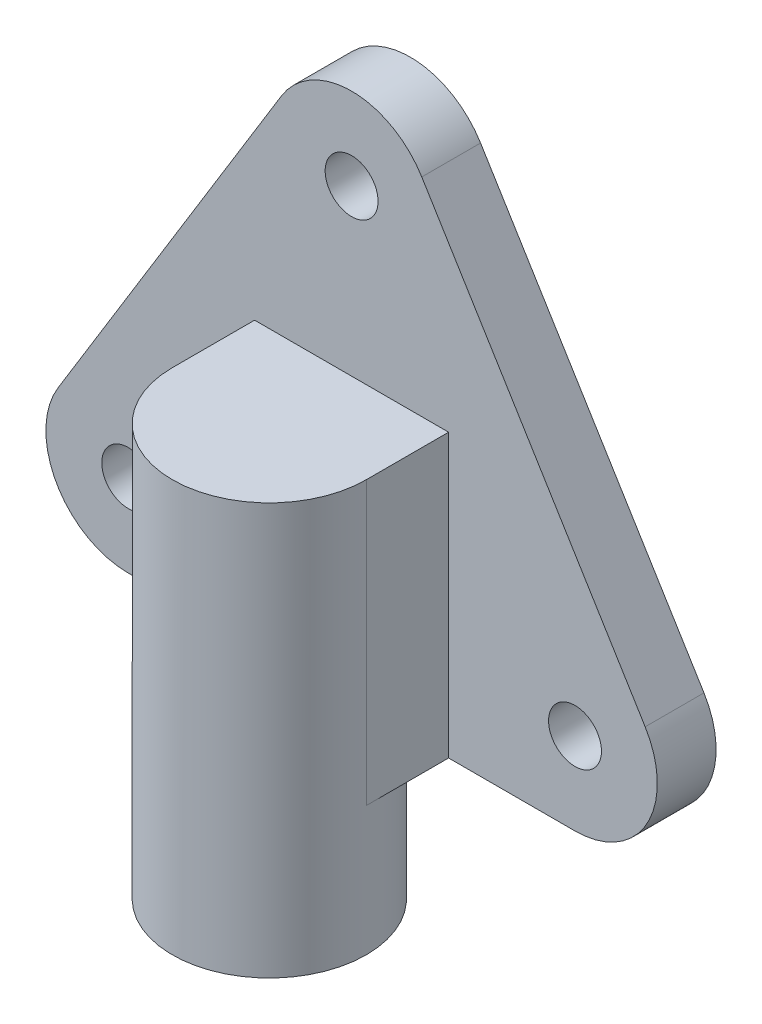
from build123d import *

# Parameters (mm, degrees)
SKETCH1_R                = 4.5
BOSS_EXTRUDE1_DEPTH      = 10
BOSS_EXTRUDE2_DEPTH      = 22
BOSS_EXTRUDE2_DEPTH_BACK = 48
SKETCH2_R                = 16.5
BOSS_EXTRUDE3_DEPTH      = 48
SKETCH5_R                = 8
CUT_EXTRUDE1_DEPTH       = 54


with BuildPart() as part:
    # Sketch1 → Boss-Extrude1 (new body)
    with BuildSketch(Plane.XY):
        with BuildLine():
            Line((-38, -14), (38, -14))
            ThreePointArc((38, -14), (50.215198798, -6.840242563), (49.936417534, 7.315868811))
            Line((49.936417534, 7.315868811), (11.936417534, 69.315868811))
            ThreePointArc((11.936417534, 69.315868811), (0, 76), (-11.936417534, 69.315868811))
            Line((-11.936417534, 69.315868811), (-49.936417534, 7.315868811))
            ThreePointArc((-49.936417534, 7.315868811), (-50.215198798, -6.840242563), (-38, -14))
        make_face()
        with Locations((0, 62)):
            Circle(SKETCH1_R, mode=Mode.SUBTRACT)
        with Locations((38, 0)):
            Circle(SKETCH1_R, mode=Mode.SUBTRACT)
        with Locations((-38, 0)):
            Circle(SKETCH1_R, mode=Mode.SUBTRACT)
    extrude(amount=BOSS_EXTRUDE1_DEPTH)

    # Sketch2 → Boss-Extrude2 (add, two sides: drawn at the far end of the back side and taken through both)
    with BuildSketch(Plane.XZ.offset(14).offset(-BOSS_EXTRUDE2_DEPTH_BACK)):
        with Locations((0, 24)):
            Circle(SKETCH2_R)
    extrude(amount=BOSS_EXTRUDE2_DEPTH + BOSS_EXTRUDE2_DEPTH_BACK)

    # Sketch2<3> → Boss-Extrude3 (add)
    with BuildSketch(Plane.XZ.offset(14)):
        with BuildLine():
            Line((-16.5, 24), (-16.5, 10))
            Line((-16.5, 10), (-8.732124598, 10))
            ThreePointArc((-8.732124598, 10), (-14.427925282, 15.994691008), (-16.5, 24))
        make_face()
        with BuildLine():
            ThreePointArc((16.5, 24), (14.427925282, 15.994691008), (8.732124598, 10))
            Line((8.732124598, 10), (16.5, 10))
            Line((16.5, 10), (16.5, 24))
        make_face()
    extrude(amount=-BOSS_EXTRUDE3_DEPTH)

    # Sketch5 → Cut-Extrude1 (cut)
    with BuildSketch(Plane.XZ.offset(36)):
        with Locations((0, 24)):
            Circle(SKETCH5_R)
    extrude(amount=-CUT_EXTRUDE1_DEPTH, mode=Mode.SUBTRACT)


solid = part.part
